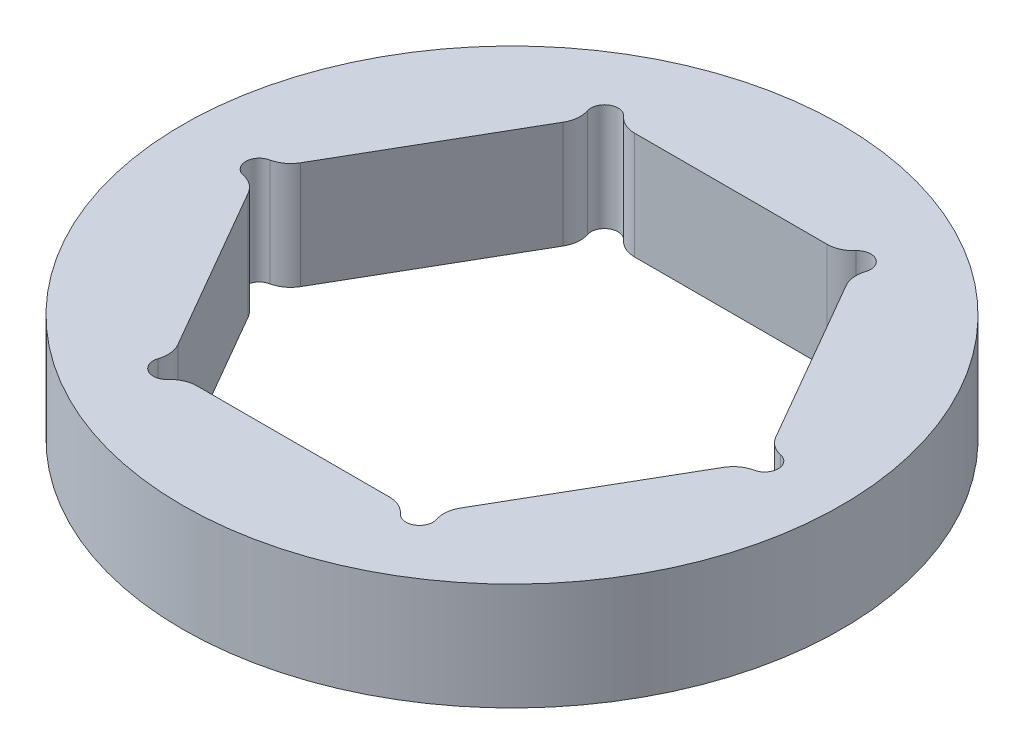
from build123d import *

# Parameters (mm, degrees)
CROQUIS1_R              = 9.7536
SALIENTE_EXTRUIR1_DEPTH = 1.5875


with BuildPart() as part:
    # Croquis1 → Saliente-Extruir1 (new, symmetric)
    with BuildSketch(Plane(origin=(0, 0, 0), x_dir=(1, 0, 0), z_dir=(0, 1, 0))):
        with Locations(Location((0, 0, 0), (0, 0, 270))):
            Circle(CROQUIS1_R)
        with BuildLine():
            Line((4.186711289, -5.702403331), (7.031781792, -0.774596669))
            ThreePointArc((7.031781792, -0.774596669), (7.255445899, -0.526605585), (7.560864296, -0.391532223))
            ThreePointArc((7.560864296, -0.391532223), (7.878995387, 0), (7.560864296, 0.391532223))
            ThreePointArc((7.560864296, 0.391532223), (7.255445899, 0.526605585), (7.031781792, 0.774596669))
            Line((7.031781792, 0.774596669), (4.186711289, 5.702403331))
            ThreePointArc((4.186711289, 5.702403331), (4.083776764, 6.020097672), (4.119509, 6.352134444))
            ThreePointArc((4.119509, 6.352134444), (3.939497694, 6.823410162), (3.441355297, 6.743666667))
            ThreePointArc((3.441355297, 6.743666667), (3.171669135, 6.546703257), (2.845070503, 6.477))
            Line((2.845070503, 6.477), (-2.845070503, 6.477))
            ThreePointArc((-2.845070503, 6.477), (-3.171669135, 6.546703257), (-3.441355297, 6.743666667))
            ThreePointArc((-3.441355297, 6.743666667), (-3.939497694, 6.823410162), (-4.119509, 6.352134444))
            ThreePointArc((-4.119509, 6.352134444), (-4.083776764, 6.020097672), (-4.186711289, 5.702403331))
            Line((-4.186711289, 5.702403331), (-7.031781792, 0.774596669))
            ThreePointArc((-7.031781792, 0.774596669), (-7.255445899, 0.526605585), (-7.560864296, 0.391532223))
            ThreePointArc((-7.560864296, 0.391532223), (-7.878995387, 0), (-7.560864296, -0.391532223))
            ThreePointArc((-7.560864296, -0.391532223), (-7.255445899, -0.526605585), (-7.031781792, -0.774596669))
            Line((-7.031781792, -0.774596669), (-4.186711289, -5.702403331))
            ThreePointArc((-4.186711289, -5.702403331), (-4.083776764, -6.020097672), (-4.119509, -6.352134444))
            ThreePointArc((-4.119509, -6.352134444), (-3.939497694, -6.823410162), (-3.441355297, -6.743666667))
            ThreePointArc((-3.441355297, -6.743666667), (-3.171669135, -6.546703257), (-2.845070503, -6.477))
            Line((-2.845070503, -6.477), (2.845070503, -6.477))
            ThreePointArc((2.845070503, -6.477), (3.171669135, -6.546703257), (3.441355297, -6.743666667))
            ThreePointArc((3.441355297, -6.743666667), (3.939497694, -6.823410162), (4.119509, -6.352134444))
            ThreePointArc((4.119509, -6.352134444), (4.083776764, -6.020097672), (4.186711289, -5.702403331))
        make_face(mode=Mode.SUBTRACT)
    extrude(amount=SALIENTE_EXTRUIR1_DEPTH, both=True)


solid = part.part
